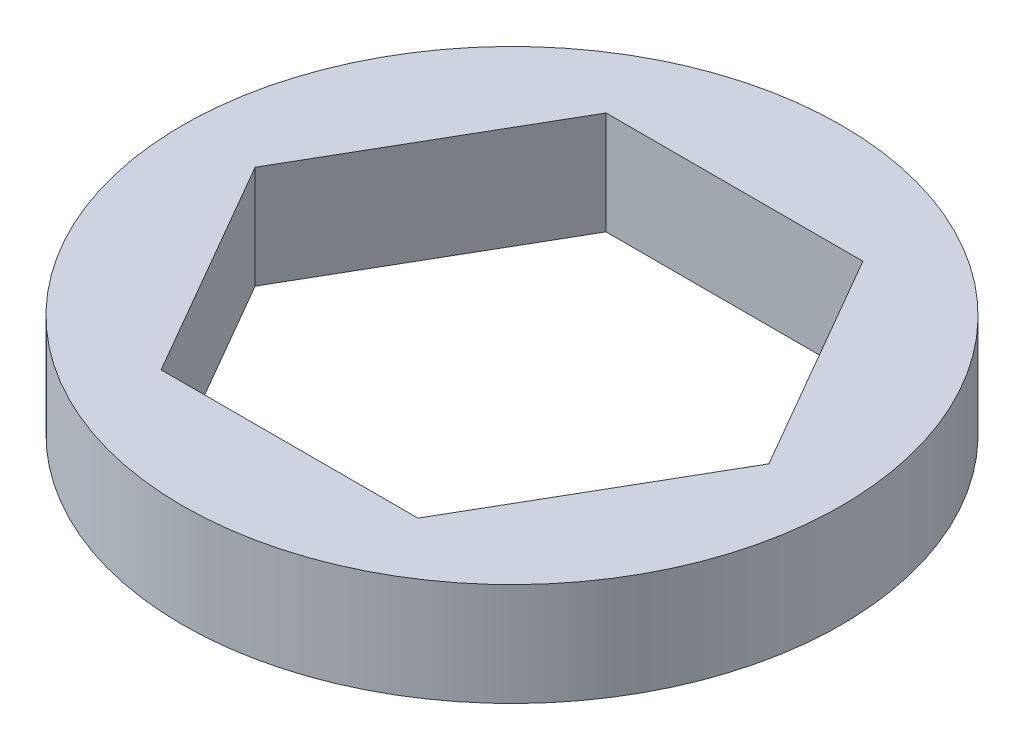
from build123d import *

# Parameters (mm, degrees)
SKETCH1_R           = 10.16
BOSS_EXTRUDE1_DEPTH = 3.175


with BuildPart() as part:
    # Sketch1 → Boss-Extrude1 (new body)
    with BuildSketch(Plane(origin=(0, 0, 0), x_dir=(1, 0, 0), z_dir=(0, 1, 0))):
        with Locations(Location((0, 0, 0), (0, 0, 270))):
            Circle(SKETCH1_R)
        Polygon((7.918936292, 0), (3.959468146, 6.858), (-3.959468146, 6.858), (-7.918936292, 0), (-3.959468146, -6.858), (3.959468146, -6.858), align=None, mode=Mode.SUBTRACT)
    extrude(amount=BOSS_EXTRUDE1_DEPTH)


solid = part.part
